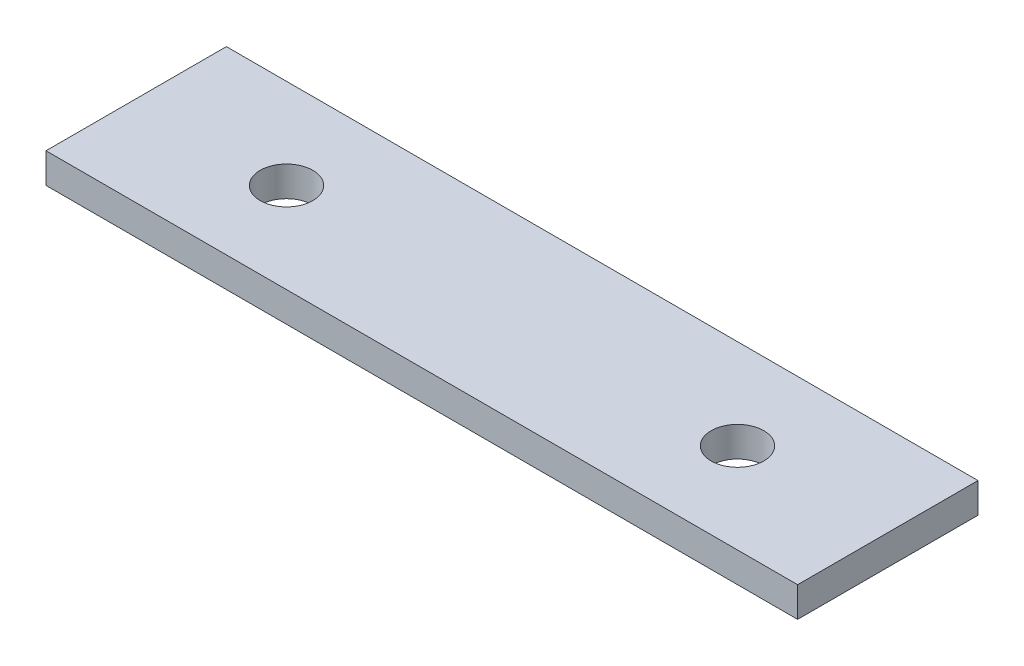
from build123d import *

# Parameters (mm, degrees)
ESBO_O1_W                = 50
ESBO_O1_H                = 12
ESBO_O1_R                = 1.75
RESSALTO_EXTRUS_O1_DEPTH = 2


with BuildPart() as part:
    # Esboço1 → Ressalto-extrusão1 (new body)
    with BuildSketch(Plane(origin=(0, 0, 0), x_dir=(1, 0, 0), z_dir=(0, 1, 0))):
        Rectangle(ESBO_O1_W, ESBO_O1_H)
        with Locations(Location((-15, 0, 0), (0, 0, 270))):
            Circle(ESBO_O1_R, mode=Mode.SUBTRACT)
        with Locations(Location((15, 0, 0), (0, 0, 270))):
            Circle(ESBO_O1_R, mode=Mode.SUBTRACT)
    extrude(amount=RESSALTO_EXTRUS_O1_DEPTH)


solid = part.part
